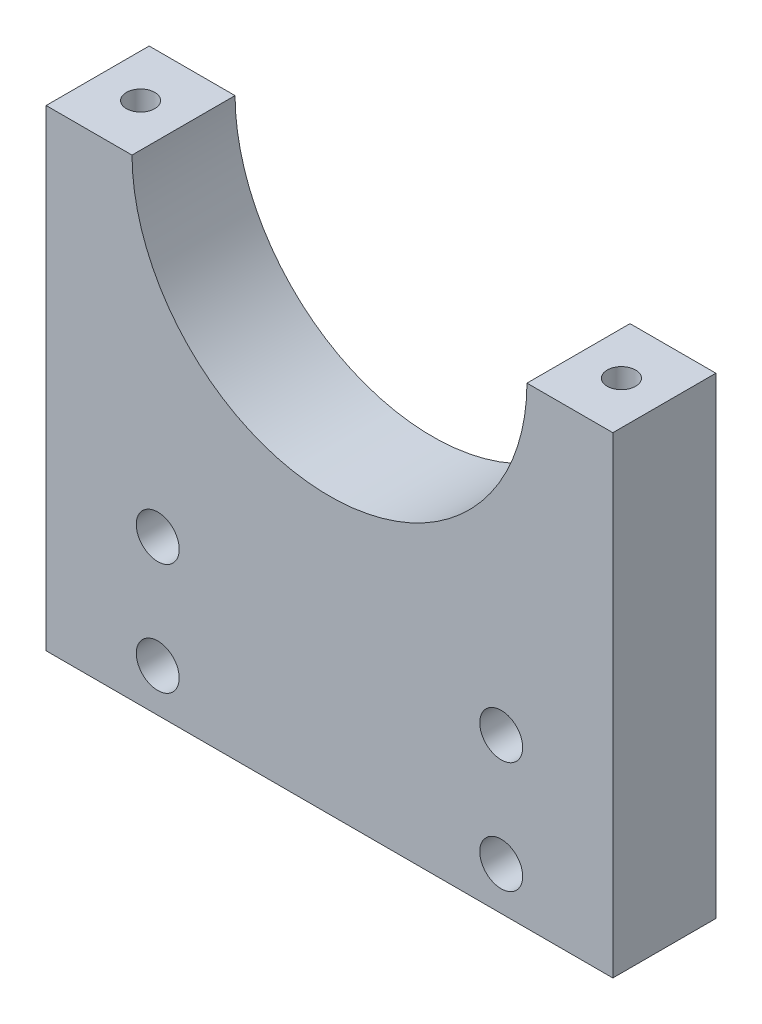
from build123d import *

# Parameters (mm, degrees)
SKETCH_1_W             = 66
SKETCH_1_H             = 55
EXTRUDE_1_DEPTH        = 12
SKETCH_2_R             = 23
CUT_EXTRUDE_1_DEPTH    = 87.746757864
HOLE_WIZARD_M6_1_D     = 5
HOLE_WIZARD_M4_1_D     = 3.3
HOLE_WIZARD_M4_1_DEPTH = 10.1
HOLE_WIZARD_M4_1_TIP   = 0.991420021


with BuildPart() as part:
    # 草图1 → 凸台-拉伸1 (new body)
    with BuildSketch(Plane.XY):
        with Locations((33, 27.5)):
            Rectangle(SKETCH_1_W, SKETCH_1_H)
    extrude(amount=EXTRUDE_1_DEPTH)

    # 草图2 → 切除-拉伸1 (cut, through all)
    with BuildSketch(Plane.XY.offset(12)):
        with Locations((33, 55.1)):
            Circle(SKETCH_2_R)
    extrude(amount=-CUT_EXTRUDE_1_DEPTH, mode=Mode.SUBTRACT)

    # M6 螺纹孔1 (through all)
    with Locations(Plane.XY.offset(12)):
        with Locations((13, 18), (53, 18), (13, 5), (53, 5)):
            Hole(HOLE_WIZARD_M6_1_D / 2)

    # M4 螺纹孔1
    with Locations(Plane(origin=(0, 55, 0), x_dir=(-1, 0, 0), z_dir=(0, 1, 0))):
        with Locations((-5, 6), (-61, 6)):
            Hole(HOLE_WIZARD_M4_1_D / 2, depth=HOLE_WIZARD_M4_1_DEPTH)
            with Locations((0, 0, -(HOLE_WIZARD_M4_1_DEPTH + HOLE_WIZARD_M4_1_TIP / 2))):  # 118° drill point
                Cone(0, HOLE_WIZARD_M4_1_D / 2, HOLE_WIZARD_M4_1_TIP, mode=Mode.SUBTRACT)


solid = part.part
